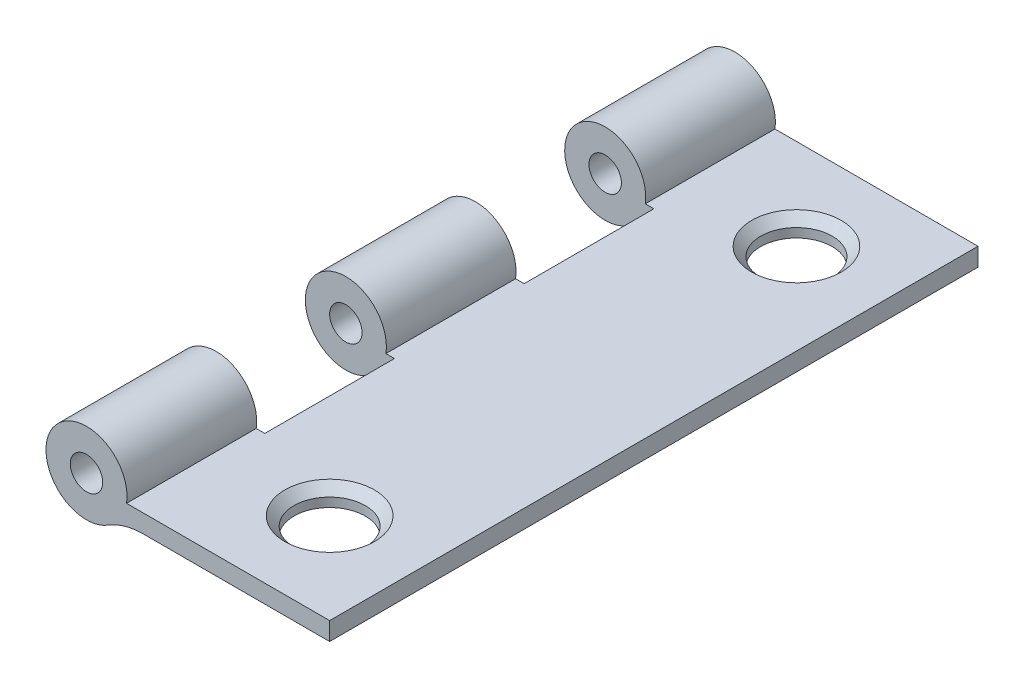
from build123d import *

# Parameters (mm, degrees)
SKETCH4_R               = 3.175
BOSS_EXTRUDE2_DEPTH     = 25.4
FILLET1_R               = 5.08
M5_CLEARANCE_HOLE1_D    = 5.6
CUT_EXTRUDE1_DEPTH      = 32.908355123
CUT_EXTRUDE1_DEPTH_BACK = 32.908355123
SKETCH9_W               = 6.985
SKETCH9_H               = 10.16
SKETCH10_R              = 1.27
CUT_EXTRUDE2_DEPTH      = 55.347245805
CHAMFER1_SIZE           = 0.7112


with BuildPart() as part:
    # Sketch4 → Boss-Extrude2 (new, symmetric)
    with BuildSketch(Plane.XY):
        Circle(SKETCH4_R)
        with BuildLine():
            Line((19.050000043, -1.905), (19.050000043, -0.4826))
            Line((19.050000043, -0.4826), (3.138108067, -0.4826))
            ThreePointArc((3.138108067, -0.4826), (2.926778646, -1.230687513), (2.54, -1.905))
            Line((2.54, -1.905), (19.050000043, -1.905))
        make_face()
    extrude(amount=BOSS_EXTRUDE2_DEPTH, both=True)

    # Fillet1
    fillet1_edges = [part.edges().sort_by_distance(p)[0] for p in [
        (2.54, -1.905, 0),
    ]]
    fillet(fillet1_edges, radius=FILLET1_R)

    # M5 Clearance Hole1 (through all)
    with Locations(Plane(origin=(0, -0.4826, 0), x_dir=(1, 0, 0), z_dir=(0, 1, 0))):
        with Locations((11.938000043, 18.288), (11.938000043, -18.288)):
            Hole(M5_CLEARANCE_HOLE1_D / 2)

    # Sketch9 → Cut-Extrude1 (cut, two sides: drawn at the far end of the back side and taken through both)
    with BuildSketch(Plane(origin=(0, 0, 0), x_dir=(1, 0, 0), z_dir=(0, 1, 0)).offset(-CUT_EXTRUDE1_DEPTH_BACK)):
        with Locations((0.3175, 10.16)):
            Rectangle(SKETCH9_W, SKETCH9_H)
        with Locations((0.3175, -10.16)):
            Rectangle(SKETCH9_W, SKETCH9_H)
    extrude(amount=CUT_EXTRUDE1_DEPTH + CUT_EXTRUDE1_DEPTH_BACK, mode=Mode.SUBTRACT)

    # Sketch10 → Cut-Extrude2 (cut, through all)
    with BuildSketch(Plane.XY.offset(25.4)):
        Circle(SKETCH10_R)
    extrude(amount=-CUT_EXTRUDE2_DEPTH, mode=Mode.SUBTRACT)

    # Chamfer1
    chamfer1_edges = [part.edges().sort_by_distance(p)[0] for p in [
        (14.738000043, -0.4826, 18.288),
        (14.738000043, -0.4826, -18.288),
    ]]
    chamfer(chamfer1_edges, length=CHAMFER1_SIZE)


solid = part.part
